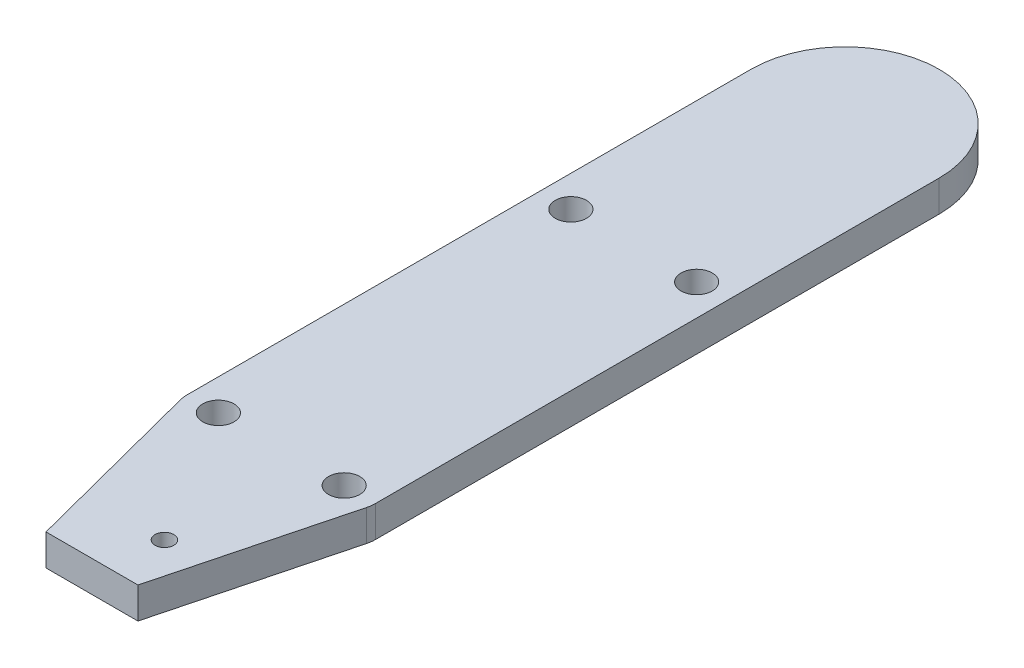
from build123d import *

# Parameters (mm, degrees)
SKETCH1_R             = 2.5
BOSS_EXTRUDE1_DEPTH   = 5
F_3_0MM_DOWEL_HOLE3_D = 3


with BuildPart() as part:
    # Sketch1 → Boss-Extrude1 (new body)
    with BuildSketch(Plane(origin=(0, 0, 0), x_dir=(1, 0, 0), z_dir=(0, 1, 0))):
        with BuildLine():
            Line((7.707562498, -0.503207604), (0.160848404, 28.52631677))
            ThreePointArc((0.160848404, 28.52631677), (0.040375116, 29.15020566), (0, 29.784335781))
            Line((0, 29.784335781), (0, 120))
            ThreePointArc((0, 120), (15.064339362, 135.064339362), (30.128678723, 120))
            Line((30.128678723, 120), (30.128678723, 29.784335781))
            ThreePointArc((30.128678723, 29.784335781), (30.088303607, 29.15020566), (29.967830319, 28.52631677))
            Line((29.967830319, 28.52631677), (22.421116226, -0.503207604))
            Line((22.421116226, -0.503207604), (7.707562498, -0.503207604))
        make_face()
        with Locations(Location((5, 29.784335781, 0), (0, 0, 270))):
            Circle(SKETCH1_R, mode=Mode.SUBTRACT)
        with Locations(Location((25.128678723, 29.784335781, 0), (0, 0, 270))):
            Circle(SKETCH1_R, mode=Mode.SUBTRACT)
        with Locations(Location((25.128678723, 86.185297163, 0), (0, 0, 270))):
            Circle(SKETCH1_R, mode=Mode.SUBTRACT)
        with Locations(Location((5, 86.185297163, 0), (0, 0, 270))):
            Circle(SKETCH1_R, mode=Mode.SUBTRACT)
    extrude(amount=BOSS_EXTRUDE1_DEPTH)

    # Ø3.0mm Dowel Hole3 (through all)
    with Locations(Plane(origin=(18.290450711, 5, -7.860888975), x_dir=(0, 0, 1), z_dir=(0, 1, 0))):
        with Locations((0, 0)):
            Hole(F_3_0MM_DOWEL_HOLE3_D / 2)


solid = part.part
